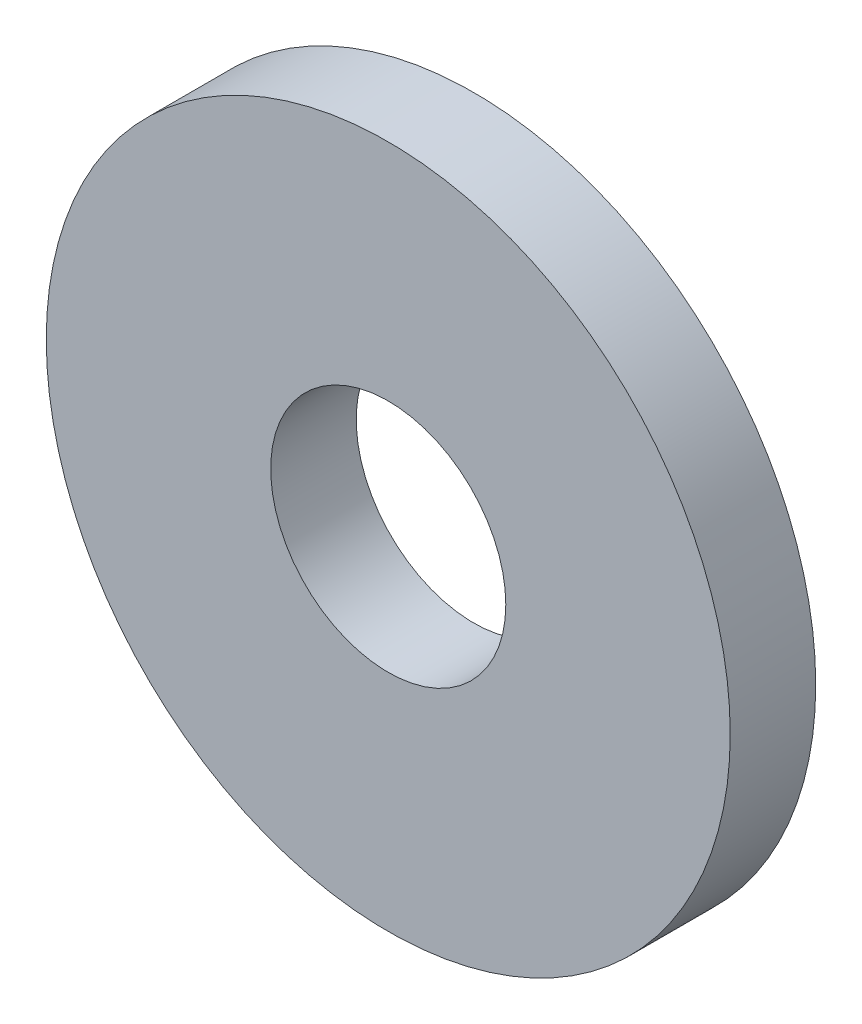
from build123d import *

# Parameters (mm, degrees)
SKETCH1_R           = 1.6
SKETCH1_R_2         = 0.55
BOSS_EXTRUDE1_DEPTH = 0.4


with BuildPart() as part:
    # Sketch1 → Boss-Extrude1 (new body)
    with BuildSketch(Plane.XY):
        Circle(SKETCH1_R)
        Circle(SKETCH1_R_2, mode=Mode.SUBTRACT)
    extrude(amount=BOSS_EXTRUDE1_DEPTH)


solid = part.part
